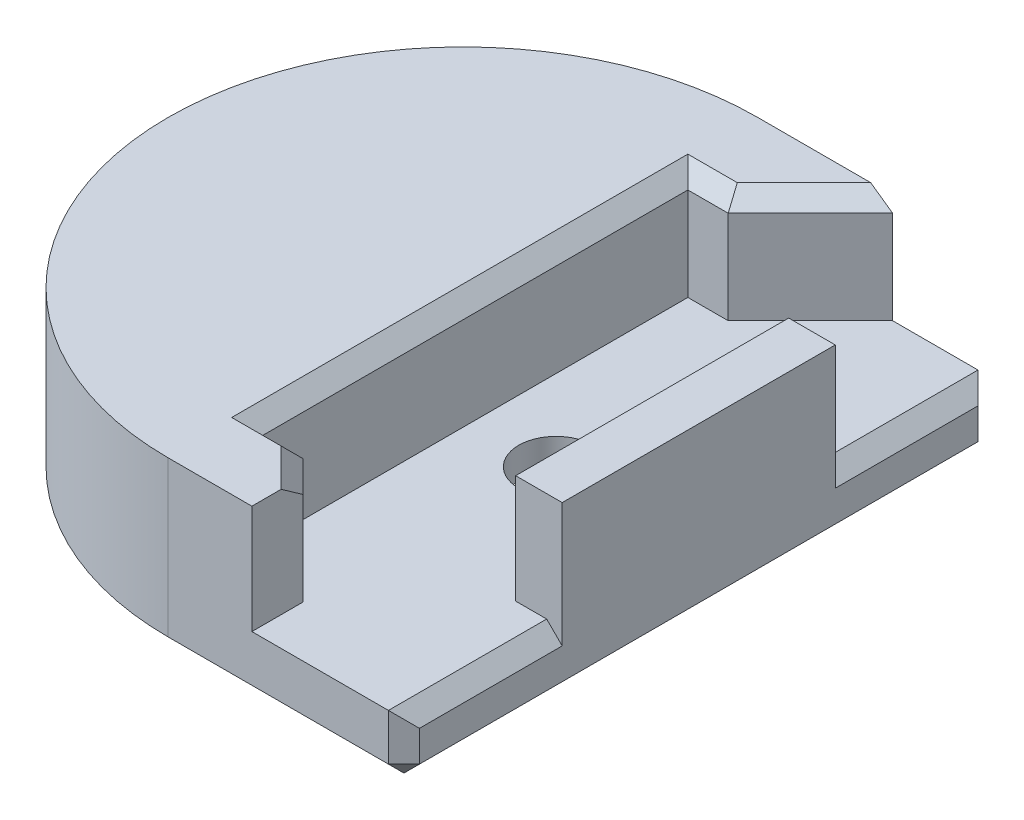
from build123d import *

# Parameters (mm, degrees)
SKETCH1_R           = 1.2
BOSS_EXTRUDE1_DEPTH = 2
SKETCH2_W           = 2
SKETCH2_H           = 8.8
BOSS_EXTRUDE2_DEPTH = 3.5
CUT_EXTRUDE1_DEPTH  = 1
CHAMFER1_SIZE       = 0.5


with BuildPart() as part:
    # Sketch1 → Boss-Extrude1 (new body)
    with BuildSketch(Plane(origin=(0, 0, 0), x_dir=(1, 0, 0), z_dir=(0, 1, 0))):
        with BuildLine():
            Line((4.6, -9.5), (4.6, 9.5))
            Line((4.6, 9.5), (-3, 9.5))
            ThreePointArc((-3, 9.5), (-12.5, 0), (-3, -9.5))
            Line((-3, -9.5), (4.6, -9.5))
        make_face()
        with Locations(Location((0, 0, 0), (0, 0, 270))):
            Circle(SKETCH1_R, mode=Mode.SUBTRACT)
    extrude(amount=BOSS_EXTRUDE1_DEPTH)

    # Sketch2 → Boss-Extrude2 (add)
    with BuildSketch(Plane(origin=(0, 2, 0), x_dir=(1, 0, 0), z_dir=(0, 1, 0))):
        with Locations((3.6, 0)):
            Rectangle(SKETCH2_W, SKETCH2_H)
        with BuildLine():
            Line((-2.6, -6.85), (-2.6, 6.85))
            Line((-2.6, 6.85), (-1.3, 6.85))
            Line((-1.3, 6.85), (1.35, 9.5))
            Line((1.35, 9.5), (-3, 9.5))
            ThreePointArc((-3, 9.5), (-12.5, 0), (-3, -9.5))
            Line((-3, -9.5), (-0.3, -9.5))
            Line((-0.3, -9.5), (-0.3, -7.85))
            Line((-0.3, -7.85), (-1.3, -6.85))
            Line((-1.3, -6.85), (-2.6, -6.85))
        make_face()
    extrude(amount=BOSS_EXTRUDE2_DEPTH)

    # Sketch3 → Cut-Extrude1 (cut)
    with BuildSketch(Plane.XZ):
        Polygon((-2.309401077, 0), (-1.154700538, -2), (1.154700538, -2), (2.309401077, 0), (1.154700538, 2), (-1.154700538, 2), align=None)
    extrude(amount=-CUT_EXTRUDE1_DEPTH, mode=Mode.SUBTRACT)

    # Chamfer1
    chamfer1_edges = [part.edges().sort_by_distance(p)[0] for p in [
        (4.6, 2, 6.95),
        (-0.8, 5.5, 7.35),
        (-1.95, 5.5, 6.85),
        (-2.6, 5.5, 0),
        (-1.95, 5.5, -6.85),
        (0.025, 5.5, -8.175),
        (4.6, 2, -6.95),
        (2.6, 3.75, -4.4),
        (2.6, 3.75, 4.4),
        (2.6, 5.5, 0),
        (4.6, 0, 0),
        (0.8, 0, 9.5),
        (-12.5, 0, 0),
        (0.8, 0, -9.5),
        (-1.732050808, 0, 1),
        (-1.732050808, 0, -1),
        (0, 0, -2),
        (1.732050808, 0, -1),
        (1.732050808, 0, 1),
        (0, 0, 2),
        (4.6, 1, -9.5),
        (4.6, 1, 9.5),
    ]]
    chamfer(chamfer1_edges, length=CHAMFER1_SIZE)


solid = part.part
